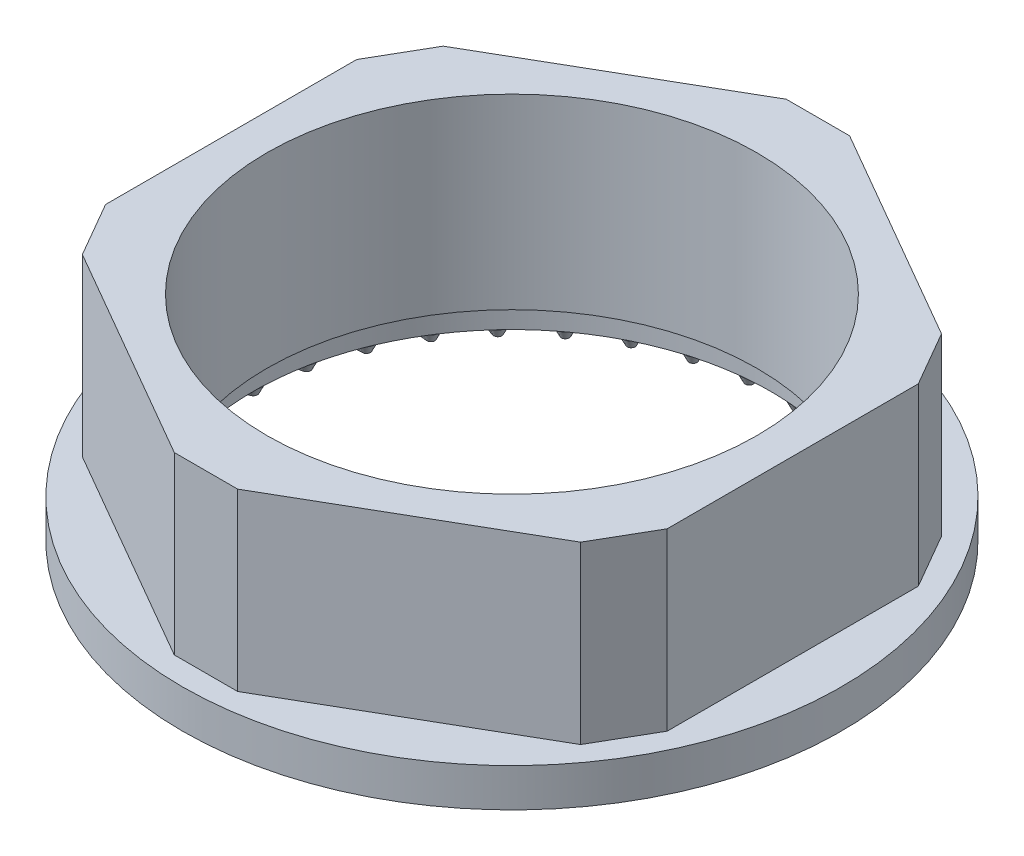
from build123d import *

# Parameters (mm, degrees)
SKETCH1_R              = 16.1417
BOSS_EXTRUDE1_DEPTH    = 10.4648
CUT_EXTRUDE1_START     = -8.5852
SKETCH2_R              = 16.1417
SKETCH2_R_2            = 11.303
CUT_EXTRUDE1_DEPTH     = 8.5852
M27X3_0_TAPPED_HOLE1_D = 24
SKETCH5_R              = 12.6746
CUT_EXTRUDE2_DEPTH     = 1.3208
BOSS_EXTRUDE3_DEPTH    = 0.4318
BOSS_EXTRUDE3_TAPER    = 26


with BuildPart() as part:
    # Sketch1 → Boss-Extrude1 (new body)
    with BuildSketch(Plane(origin=(0, 0, 0), x_dir=(1, 0, 0), z_dir=(0, 1, 0))):
        Circle(SKETCH1_R)
    extrude(amount=BOSS_EXTRUDE1_DEPTH)

    # Sketch2 → Cut-Extrude1 (cut)
    # profile 1 of 2: a face of its own
    with BuildSketch(Plane(origin=(0, 10.4648, 0), x_dir=(1, 0, 0), z_dir=(0, 1, 0)).offset(CUT_EXTRUDE1_START)):
        Circle(SKETCH2_R)
        Polygon((12.202413402, -8.836800012), (1.551686598, -14.986), (-1.551686598, -14.986), (-12.202413402, -8.836800012), (-13.7541, -6.149199988), (-13.7541, 6.149199988), (-12.202413402, 8.836800012), (-1.551686598, 14.986), (1.551686598, 14.986), (12.202413402, 8.836800012), (13.7541, 6.149199988), (13.7541, -6.149199988), align=None, mode=Mode.SUBTRACT)
    # profile 2 of 2: a face of its own
    with BuildSketch(Plane(origin=(0, 10.4648, 0), x_dir=(1, 0, 0), z_dir=(0, 1, 0)).offset(CUT_EXTRUDE1_START)):
        Circle(SKETCH2_R_2)
    extrude(amount=CUT_EXTRUDE1_DEPTH, mode=Mode.SUBTRACT)

    # M27x3.0 Tapped Hole1 (through all)
    with Locations(Plane(origin=(0, 0, 0), x_dir=(-1, 0, 0), z_dir=(0, -1, 0))):
        with Locations((0, 0)):
            Hole(M27X3_0_TAPPED_HOLE1_D / 2)

    # Sketch5 → Cut-Extrude2 (cut)
    with BuildSketch(Plane.XZ):
        Circle(SKETCH5_R)
    extrude(amount=-CUT_EXTRUDE2_DEPTH, mode=Mode.SUBTRACT)

    # Sketch6 → Boss-Extrude3 (add)
    with BuildSketch(Plane.XZ):
        with BuildLine():
            ThreePointArc((-0.174088388, 13.228105217), (0.009671378, 12.693581147), (0.550121715, 12.859101739))
            Line((0.550121715, 12.859101739), (1.523257355, 14.768987971))
            ThreePointArc((1.523257355, 14.768987971), (1.33949759, 15.303512041), (0.799047253, 15.137991449))
            Line((0.799047253, 15.137991449), (-0.174088388, 13.228105217))
        make_face()
        with BuildLine():
            ThreePointArc((2.190678675, 13.046608806), (2.276042388, 12.487863185), (2.837362309, 12.554222659))
            Line((2.837362309, 12.554222659), (4.135882615, 14.259656155))
            ThreePointArc((4.135882615, 14.259656155), (4.050518902, 14.818401777), (3.489198981, 14.752042303))
            Line((3.489198981, 14.752042303), (2.190678675, 13.046608806))
        make_face()
        with BuildLine():
            ThreePointArc((4.485035524, 12.445783654), (4.469259524, 11.880775025), (5.033407744, 11.845840533))
            Line((5.033407744, 11.845840533), (6.615577203, 13.292007257))
            ThreePointArc((6.615577203, 13.292007257), (6.631353204, 13.857015886), (6.067204984, 13.891950379))
            Line((6.067204984, 13.891950379), (4.485035524, 12.445783654))
        make_face()
        with BuildLine():
            ThreePointArc((6.63523964, 11.444940774), (6.518830981, 10.89182898), (7.067675312, 10.756723345))
            Line((7.067675312, 10.756723345), (8.882641698, 11.89714231))
            ThreePointArc((8.882641698, 11.89714231), (8.999050358, 12.450254104), (8.450206026, 12.585359739))
            Line((8.450206026, 12.585359739), (6.63523964, 11.444940774))
        make_face()
        with BuildLine():
            ThreePointArc((8.572181695, 10.076248081), (8.358881846, 9.55281059), (8.874781981, 9.321876218))
            Line((8.874781981, 9.321876218), (10.864210779, 10.119893419))
            ThreePointArc((10.864210779, 10.119893419), (11.077510628, 10.64333091), (10.561610493, 10.874265282))
            Line((10.561610493, 10.874265282), (8.572181695, 10.076248081))
        make_face()
        with BuildLine():
            ThreePointArc((10.233606778, 8.383696484), (9.930271372, 7.906757007), (10.396645855, 7.58741632))
            Line((10.396645855, 7.58741632), (12.496595187, 8.017382827))
            ThreePointArc((12.496595187, 8.017382827), (12.799930593, 8.494322304), (12.33355611, 8.813662991))
            Line((12.33355611, 8.813662991), (10.233606778, 8.383696484))
        make_face()
        with BuildLine():
            ThreePointArc((11.566115318, 6.421685983), (11.182493804, 6.006573748), (11.584352976, 5.609090618))
            Line((11.584352976, 5.609090618), (13.727328743, 5.657186955))
            ThreePointArc((13.727328743, 5.657186955), (14.110950256, 6.07229919), (13.709091085, 6.46978232))
            Line((13.709091085, 6.46978232), (11.566115318, 6.421685983))
        make_face()
        with BuildLine():
            ThreePointArc((12.526879395, 4.253277212), (12.075301685, 3.913334267), (12.399729461, 3.450484128))
            Line((12.399729461, 3.450484128), (14.516854659, 3.115164439))
            ThreePointArc((14.516854659, 3.115164439), (14.968432368, 3.455107383), (14.644004592, 3.917957522))
            Line((14.644004592, 3.917957522), (12.526879395, 4.253277212))
        make_face()
        with BuildLine():
            ThreePointArc((13.085019261, 1.948164611), (12.579999434, 1.694317003), (12.816568439, 1.18097624))
            Line((12.816568439, 1.18097624), (14.839796921, 0.473017975))
            ThreePointArc((14.839796921, 0.473017975), (15.344816748, 0.726865583), (15.108247743, 1.240206346))
            Line((15.108247743, 1.240206346), (13.085019261, 1.948164611))
        make_face()
        with BuildLine():
            ThreePointArc((13.222595842, -0.419563604), (12.680365651, -0.579157004), (12.821472362, -1.126489197))
            Line((12.821472362, -1.126489197), (14.6857759, -2.184331676))
            ThreePointArc((14.6857759, -2.184331676), (15.228006091, -2.024738276), (15.08689938, -1.477406083))
            Line((15.08689938, -1.477406083), (13.222595842, -0.419563604))
        make_face()
        with BuildLine():
            ThreePointArc((12.935187312, -2.773806698), (12.373174482, -2.834016428), (12.414283613, -3.397748343))
            Line((12.414283613, -3.397748343), (14.059741959, -4.77147511))
            ThreePointArc((14.059741959, -4.77147511), (14.621754789, -4.711265381), (14.580645658, -4.147533465))
            Line((14.580645658, -4.147533465), (12.935187312, -2.773806698))
        make_face()
        with BuildLine():
            ThreePointArc((12.23203122, -5.038897364), (11.668299305, -4.997788233), (11.608089575, -5.559801063))
            Line((11.608089575, -5.559801063), (12.981816342, -7.205259408))
            ThreePointArc((12.981816342, -7.205259408), (13.545548257, -7.246368539), (13.605757987, -6.684355709))
            Line((13.605757987, -6.684355709), (12.23203122, -5.038897364))
        make_face()
        with BuildLine():
            ThreePointArc((11.135727579, -7.142033722), (10.588395387, -7.000927011), (10.428801986, -7.543157201))
            Line((10.428801986, -7.543157201), (11.486644466, -9.40746074))
            ThreePointArc((11.486644466, -9.40746074), (12.033976659, -9.548567451), (12.193570059, -9.00633726))
            Line((12.193570059, -9.00633726), (11.135727579, -7.142033722))
        make_face()
        with BuildLine():
            ThreePointArc((9.681512492, -9.01561924), (9.168171729, -8.779050235), (8.914324121, -9.284070061))
            Line((8.914324121, -9.284070061), (9.622282386, -11.307298543))
            ThreePointArc((9.622282386, -11.307298543), (10.135623149, -11.543867548), (10.389470757, -11.038847722))
            Line((10.389470757, -11.038847722), (9.681512492, -9.01561924))
        make_face()
        with BuildLine():
            ThreePointArc((7.916125627, -10.599435337), (7.453275488, -10.275007561), (7.113332544, -10.72658527))
            Line((7.113332544, -10.72658527), (7.448652233, -12.843710467))
            ThreePointArc((7.448652233, -12.843710467), (7.911502372, -13.168138244), (8.251445317, -12.716560534))
            Line((8.251445317, -12.716560534), (7.916125627, -10.599435337))
        make_face()
        with BuildLine():
            ThreePointArc((5.896307971, -11.842576861), (5.498824841, -11.440717689), (5.083712606, -11.824339203))
            Line((5.083712606, -11.824339203), (5.035616269, -13.96731497))
            ThreePointArc((5.035616269, -13.96731497), (5.433099399, -14.369174141), (5.848211634, -13.985552628))
            Line((5.848211634, -13.985552628), (5.896307971, -11.842576861))
        make_face()
        with BuildLine():
            ThreePointArc((3.686978126, -12.705088221), (3.367637439, -12.238713738), (2.890697962, -12.542049144))
            Line((2.890697962, -12.542049144), (2.460731454, -14.641998476))
            ThreePointArc((2.460731454, -14.641998476), (2.780072141, -15.108372959), (3.257011618, -14.805037553))
            Line((3.257011618, -14.805037553), (3.686978126, -12.705088221))
        make_face()
        with BuildLine():
            ThreePointArc((1.359145769, -13.159247592), (1.128211398, -12.643347457), (0.604773907, -12.856647306))
            Line((0.604773907, -12.856647306), (-0.193243294, -14.846076104))
            ThreePointArc((-0.193243294, -14.846076104), (0.037691077, -15.361976239), (0.561128568, -15.14867639))
            Line((0.561128568, -15.14867639), (1.359145769, -13.159247592))
        make_face()
        with BuildLine():
            ThreePointArc((-1.01237065, -13.190457917), (-1.147476285, -12.641613586), (-1.700588079, -12.758022246))
            Line((-1.700588079, -12.758022246), (-2.841007044, -14.572988631))
            ThreePointArc((-2.841007044, -14.572988631), (-2.705901409, -15.121832963), (-2.152789615, -15.005424303))
            Line((-2.152789615, -15.005424303), (-1.01237065, -13.190457917))
        make_face()
        with BuildLine():
            ThreePointArc((-3.351348644, -12.797716073), (-3.386283136, -12.233567852), (-3.951291765, -12.249343853))
            Line((-3.951291765, -12.249343853), (-5.39745849, -13.831513313))
            ThreePointArc((-5.39745849, -13.831513313), (-5.362523998, -14.395661533), (-4.797515369, -14.379885532))
            Line((-4.797515369, -14.379885532), (-3.351348644, -12.797716073))
        make_face()
        with BuildLine():
            ThreePointArc((-5.582611535, -11.993645103), (-5.516252061, -11.432325182), (-6.074997683, -11.34696147))
            Line((-6.074997683, -11.34696147), (-7.780431179, -12.645481776))
            ThreePointArc((-7.780431179, -12.645481776), (-7.846790653, -13.206801696), (-7.288045031, -13.292165409))
            Line((-7.288045031, -13.292165409), (-5.582611535, -11.993645103))
        make_face()
        with BuildLine():
            ThreePointArc((-7.634444698, -10.804088511), (-7.468924106, -10.263638175), (-8.003448176, -10.079878409))
            Line((-8.003448176, -10.079878409), (-9.913334408, -11.05301405))
            ThreePointArc((-9.913334408, -11.05301405), (-10.078855, -11.593464386), (-9.54433093, -11.777224152))
            Line((-9.54433093, -11.777224152), (-7.634444698, -10.804088511))
        make_face()
        with BuildLine():
            ThreePointArc((-9.440900526, -9.267279625), (-9.181538785, -8.765069391), (-9.67466126, -8.488819762))
            Line((-9.67466126, -8.488819762), (-11.727614913, -9.105293357))
            ThreePointArc((-11.727614913, -9.105293357), (-11.986976655, -9.607503592), (-11.493854179, -9.883753221))
            Line((-11.493854179, -9.883753221), (-9.440900526, -9.267279625))
        make_face()
        with BuildLine():
            ThreePointArc((-10.943918044, -7.432612747), (-10.599051252, -6.984784065), (-11.03492277, -6.624923463))
            Line((-11.03492277, -6.624923463), (-13.164960224, -6.864921045))
            ThreePointArc((-13.164960224, -6.864921045), (-13.509827016, -7.312749728), (-13.073955498, -7.672610329))
            Line((-13.073955498, -7.672610329), (-10.943918044, -7.432612747))
        make_face()
        with BuildLine():
            ThreePointArc((-12.095189031, -5.35905558), (-11.675901492, -4.980002032), (-12.040512783, -4.548096673))
            Line((-12.040512783, -4.548096673), (-14.179172882, -4.403904522))
            ThreePointArc((-14.179172882, -4.403904522), (-14.598460422, -4.78295807), (-14.23384913, -5.214863428))
            Line((-14.23384913, -5.214863428), (-12.095189031, -5.35905558))
        make_face()
        with BuildLine():
            ThreePointArc((-12.857710691, -3.113253956), (-12.37747865, -2.815158636), (-12.659110809, -2.325090314))
            Line((-12.659110809, -2.325090314), (-14.737655257, -1.801342884))
            ThreePointArc((-14.737655257, -1.801342884), (-15.217887298, -2.099438204), (-14.936255139, -2.589506526))
            Line((-14.936255139, -2.589506526), (-12.857710691, -3.113253956))
        make_face()
        with BuildLine():
            ThreePointArc((-13.20697495, -0.767389789), (-12.68123346, -0.559833726), (-12.870834597, -0.027353639))
            Line((-12.870834597, -0.027353639), (-14.822457266, 0.859115397))
            ThreePointArc((-14.822457266, 0.859115397), (-15.348198755, 0.651559333), (-15.158597619, 0.119079247))
            Line((-15.158597619, 0.119079247), (-13.20697495, -0.767389789))
        make_face()
        with BuildLine():
            ThreePointArc((-13.131756167, 1.603138917), (-12.577402993, 1.713484702), (-12.668879171, 2.271262204))
            Line((-12.668879171, 2.271262204), (-14.430853302, 3.491961002))
            ThreePointArc((-14.430853302, 3.491961002), (-14.985206476, 3.381615217), (-14.893730298, 2.823837715))
            Line((-14.893730298, 2.823837715), (-13.131756167, 1.603138917))
        make_face()
        with BuildLine():
            ThreePointArc((-12.634471936, 3.922141419), (-12.069324445, 3.931730321), (-12.059735544, 4.496877811))
            Line((-12.059735544, 4.496877811), (-13.57542984, 6.012572107))
            ThreePointArc((-13.57542984, 6.012572107), (-14.14057733, 6.002983205), (-14.150166231, 5.437835715))
            Line((-14.150166231, 5.437835715), (-12.634471936, 3.922141419))
        make_face()
        with BuildLine():
            ThreePointArc((-11.731105381, 6.115083069), (-11.173327879, 6.023606892), (-11.062982094, 6.577960065))
            Line((-11.062982094, 6.577960065), (-12.283680892, 8.339934197))
            ThreePointArc((-12.283680892, 8.339934197), (-12.841458394, 8.431410374), (-12.951804179, 7.877057201))
            Line((-12.951804179, 7.877057201), (-11.731105381, 6.115083069))
        make_face()
        with BuildLine():
            ThreePointArc((-10.450691447, 8.111480918), (-9.918211361, 7.921879782), (-9.710655297, 8.447621271))
            Line((-9.710655297, 8.447621271), (-10.597124333, 10.39924394))
            ThreePointArc((-10.597124333, 10.39924394), (-11.12960442, 10.588845077), (-11.337160483, 10.063103587))
            Line((-11.337160483, 10.063103587), (-10.450691447, 8.111480918))
        make_face()
        with BuildLine():
            ThreePointArc((-8.834383691, 9.847169096), (-8.344315369, 9.565536937), (-8.046220049, 10.045768978))
            Line((-8.046220049, 10.045768978), (-8.569967479, 12.124313427))
            ThreePointArc((-8.569967479, 12.124313427), (-9.060035801, 12.405945585), (-9.358131122, 11.925713545))
            Line((-9.358131122, 11.925713545), (-8.834383691, 9.847169096))
        make_face()
        with BuildLine():
            ThreePointArc((-6.934131574, 11.266361157), (-6.502226216, 10.901749865), (-6.123172668, 11.321037405))
            Line((-6.123172668, 11.321037405), (-6.267364819, 13.459697504))
            ThreePointArc((-6.267364819, 13.459697504), (-6.699270178, 13.824308795), (-7.078323726, 13.405021256))
            Line((-7.078323726, 13.405021256), (-6.934131574, 11.266361157))
        make_face()
        with BuildLine():
            ThreePointArc((-4.811010763, 12.3234431), (-4.451150162, 11.887571582), (-4.003321479, 12.232438374))
            Line((-4.003321479, 12.232438374), (-3.763323897, 14.362475828))
            ThreePointArc((-3.763323897, 14.362475828), (-4.123184499, 14.798347346), (-4.571013181, 14.453480554))
            Line((-4.571013181, 14.453480554), (-4.811010763, 12.3234431))
        make_face()
        with BuildLine():
            ThreePointArc((-2.533260108, 12.984439442), (-2.257010479, 12.491316967), (-1.754800244, 12.750678709))
            Line((-1.754800244, 12.750678709), (-1.138326648, 14.803632362))
            ThreePointArc((-1.138326648, 14.803632362), (-1.414576277, 15.296754837), (-1.916786512, 15.037393095))
            Line((-1.916786512, 15.037393095), (-2.533260108, 12.984439442))
        make_face()
    extrude(amount=BOSS_EXTRUDE3_DEPTH, taper=BOSS_EXTRUDE3_TAPER)


solid = part.part
